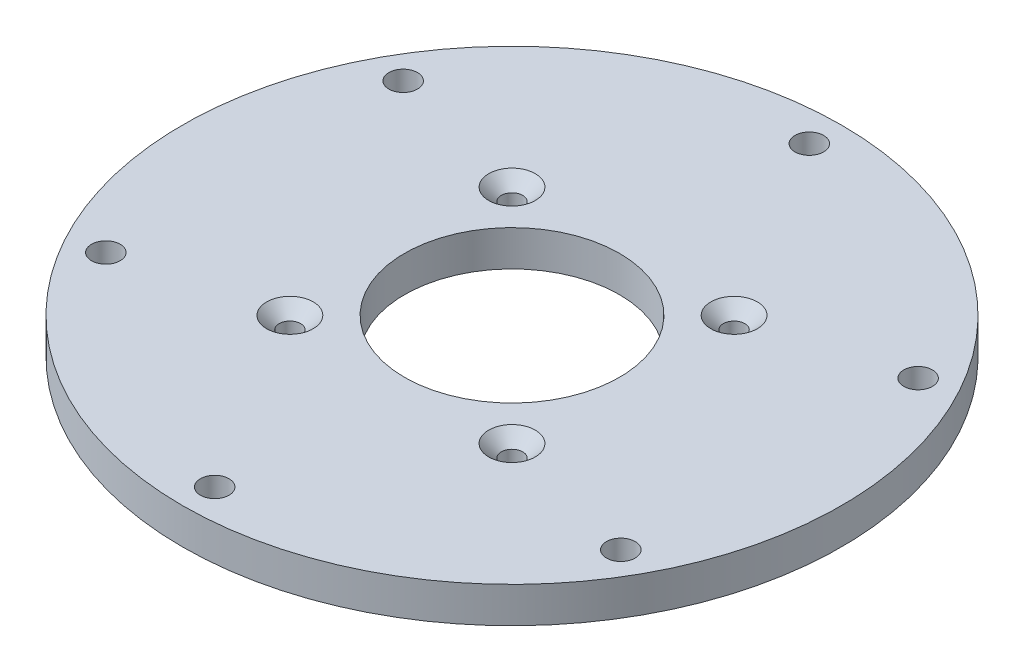
from build123d import *

# Parameters (mm, degrees)
SKETCH1_R                                            = 46
SKETCH1_R_2                                          = 1.5
BOSS_EXTRUDE1_DEPTH                                  = 5
SKETCH3_R                                            = 2
CUT_EXTRUDE2_DEPTH                                   = 66.245689513
SKETCH7_R                                            = 15
CUT_EXTRUDE3_DEPTH                                   = 66.245689513
CSK_FOR_M3_SOCKET_COUNTERSUNK_HEAD_SCREW_D           = 2.8
CSK_FOR_M3_SOCKET_COUNTERSUNK_HEAD_SCREW_CSINK_D     = 6.5
CSK_FOR_M3_SOCKET_COUNTERSUNK_HEAD_SCREW_CSINK_ANGLE = 90


with BuildPart() as part:
    # Sketch1 → Boss-Extrude1 (new body)
    with BuildSketch(Plane(origin=(0, 0, 0), x_dir=(1, 0, 0), z_dir=(0, 1, 0))):
        Circle(SKETCH1_R)
        with Locations((-15.5, -15.5)):
            Circle(SKETCH1_R_2, mode=Mode.SUBTRACT)
        with Locations((15.5, -15.5)):
            Circle(SKETCH1_R_2, mode=Mode.SUBTRACT)
        with Locations((-15.5, 15.5)):
            Circle(SKETCH1_R_2, mode=Mode.SUBTRACT)
        with Locations((15.5, 15.5)):
            Circle(SKETCH1_R_2, mode=Mode.SUBTRACT)
    extrude(amount=BOSS_EXTRUDE1_DEPTH)

    # Sketch3 → Cut-Extrude2 (cut, through all)
    with BuildSketch(Plane.XZ):
        with Locations((0, 41.5)):
            Circle(SKETCH3_R)
        with Locations((35.940054257, 20.75)):
            Circle(SKETCH3_R)
        with Locations((35.940054257, -20.75)):
            Circle(SKETCH3_R)
        with Locations((0, -41.5)):
            Circle(SKETCH3_R)
        with Locations((-35.940054257, -20.75)):
            Circle(SKETCH3_R)
        with Locations((-35.940054257, 20.75)):
            Circle(SKETCH3_R)
    extrude(amount=-CUT_EXTRUDE2_DEPTH, mode=Mode.SUBTRACT)

    # Sketch7 → Cut-Extrude3 (cut, through all)
    with BuildSketch(Plane.XZ):
        Circle(SKETCH7_R)
    extrude(amount=-CUT_EXTRUDE3_DEPTH, mode=Mode.SUBTRACT)

    # CSK for M3 socket countersunk head screw1 (through all)
    with Locations(Plane(origin=(15.5, 5, -15.5), x_dir=(0, 0, 1), z_dir=(0, 1, 0))):
        with Locations((0, 0), (31, 0), (31, -31), (0, -31)):
            CounterSinkHole(CSK_FOR_M3_SOCKET_COUNTERSUNK_HEAD_SCREW_D / 2, CSK_FOR_M3_SOCKET_COUNTERSUNK_HEAD_SCREW_CSINK_D / 2, counter_sink_angle=CSK_FOR_M3_SOCKET_COUNTERSUNK_HEAD_SCREW_CSINK_ANGLE)


solid = part.part
